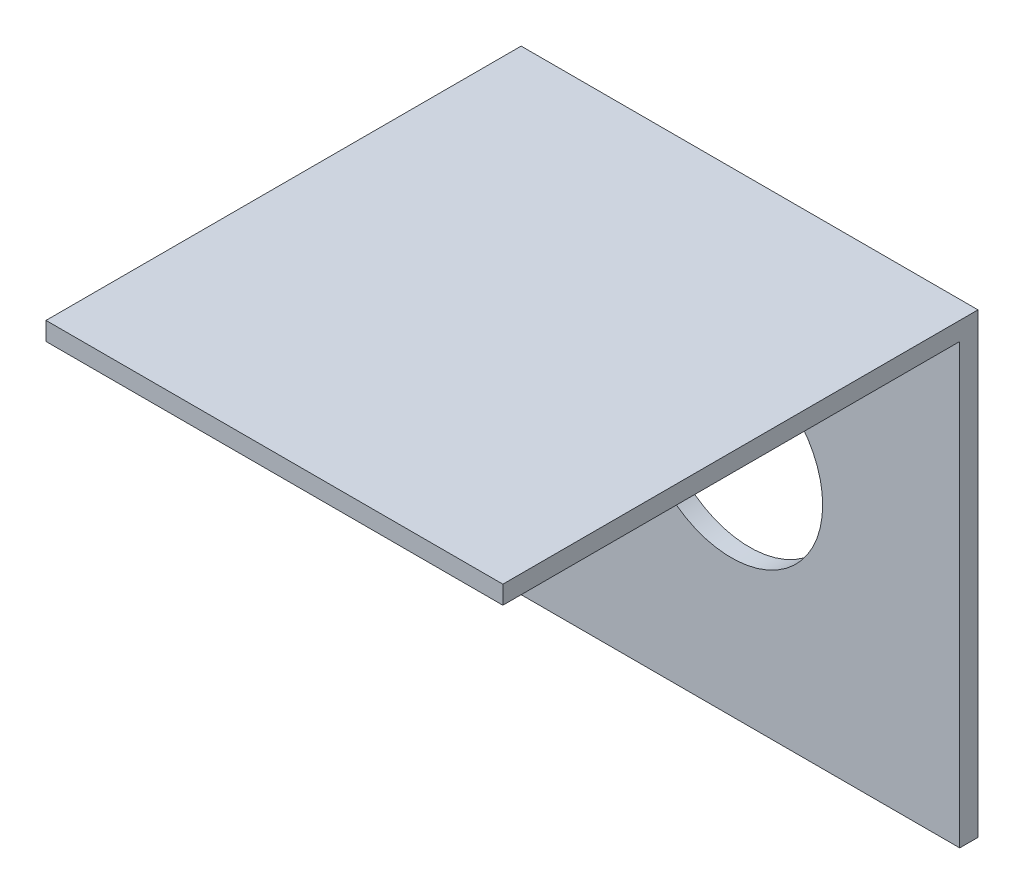
from build123d import *

# Parameters (mm, degrees)
SKETCH1_W           = 50
SKETCH1_H           = 50
BOSS_EXTRUDE1_DEPTH = 2
SKETCH2_W           = 50
SKETCH2_H           = 2
BOSS_EXTRUDE2_DEPTH = 50
SKETCH3_R           = 10
CUT_EXTRUDE2_DEPTH  = 20


with BuildPart() as part:
    # Sketch1 → Boss-Extrude1 (new body)
    with BuildSketch(Plane.XY):
        Rectangle(SKETCH1_W, SKETCH1_H)
    extrude(amount=BOSS_EXTRUDE1_DEPTH)

    # Sketch2 → Boss-Extrude2 (add)
    with BuildSketch(Plane.XY.offset(2)):
        with Locations((0, 24)):
            Rectangle(SKETCH2_W, SKETCH2_H)
    extrude(amount=BOSS_EXTRUDE2_DEPTH)

    # Sketch3 → Cut-Extrude2 (cut)
    with BuildSketch(Plane(origin=(0, 0, 0), x_dir=(-1, 0, 0), z_dir=(0, 0, -1))):
        Circle(SKETCH3_R)
    extrude(amount=-CUT_EXTRUDE2_DEPTH, mode=Mode.SUBTRACT)


solid = part.part
